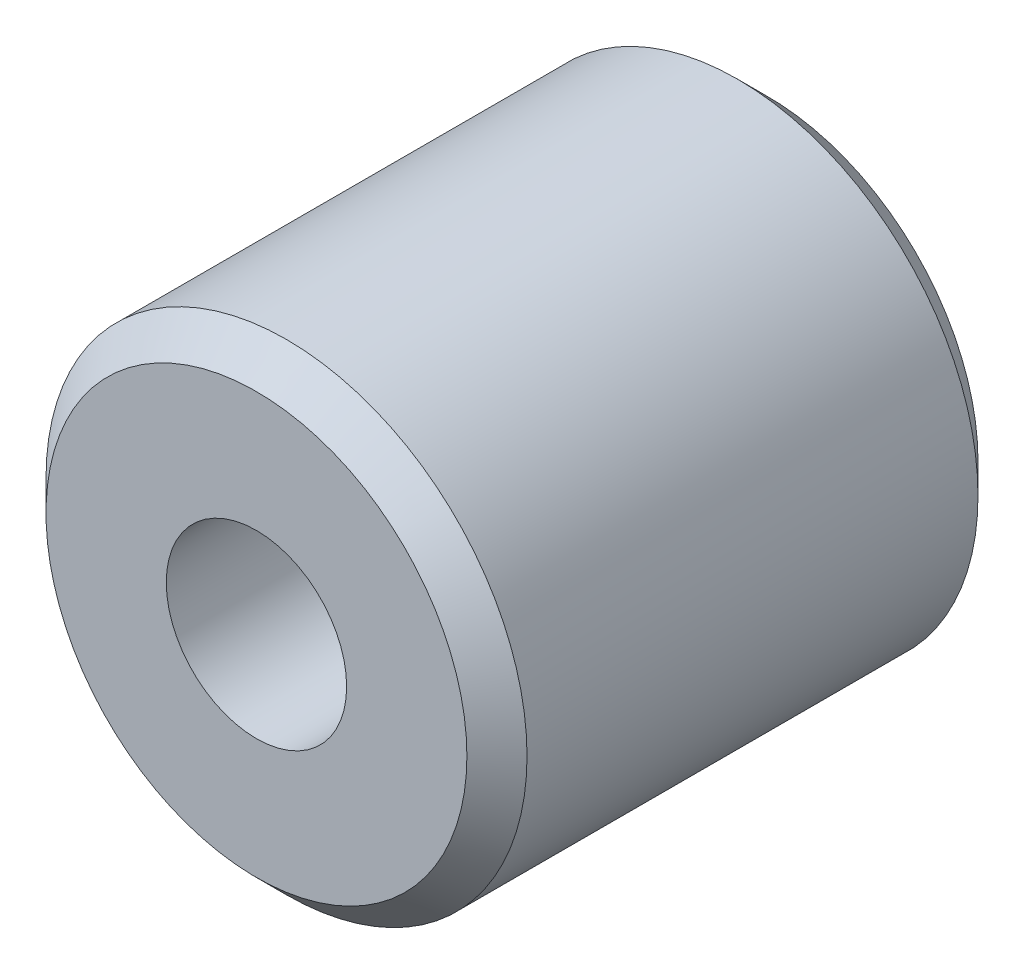
from build123d import *

# Parameters (mm, degrees)
SKETCH1_R           = 4
SKETCH1_R_2         = 1.5
BOSS_EXTRUDE1_DEPTH = 8.5
CHAMFER1_SIZE       = 0.5


with BuildPart() as part:
    # Sketch1 → Boss-Extrude1 (new body)
    with BuildSketch(Plane.XY):
        Circle(SKETCH1_R)
        Circle(SKETCH1_R_2, mode=Mode.SUBTRACT)
    extrude(amount=-BOSS_EXTRUDE1_DEPTH)

    # Chamfer1
    chamfer1_edges = [part.edges().sort_by_distance(p)[0] for p in [
        (-4, 0, 0),
        (-4, 0, -8.5),
    ]]
    chamfer(chamfer1_edges, length=CHAMFER1_SIZE)


solid = part.part
